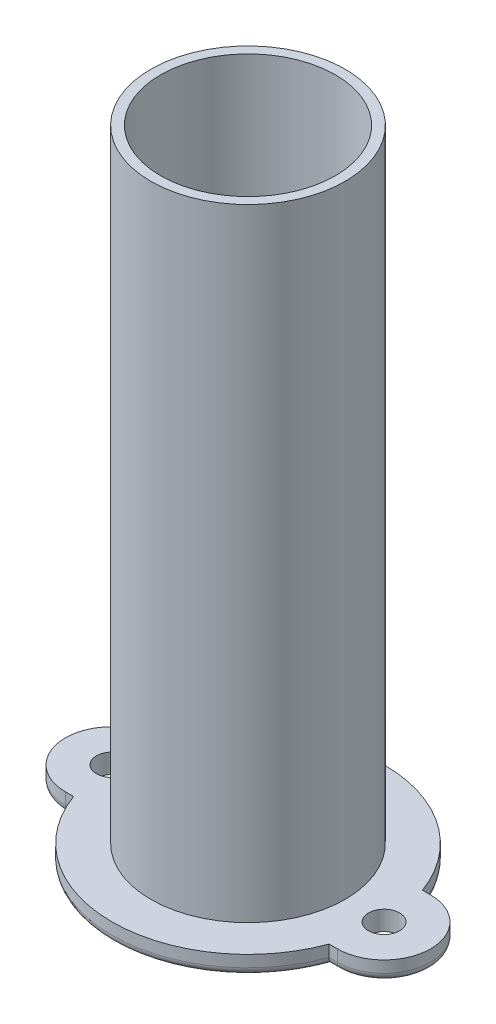
from build123d import *

# Parameters (mm, degrees)
CROQUIS1_R              = 11.25
CROQUIS1_R_2            = 2
SALIENTE_EXTRUIR2_DEPTH = 2.5
CROQUIS2_R              = 12.5
CROQUIS2_R_2            = 11.25
SALIENTE_EXTRUIR4_DEPTH = 80
REDONDEO1_R             = 1


with BuildPart() as part:
    # Croquis1 → Saliente-Extruir2 (new body)
    with BuildSketch(Plane(origin=(0, 0, 0), x_dir=(1, 0, 0), z_dir=(0, 1, 0))):
        with BuildLine():
            Line((-17.5, 6), (-16.439282223, 6))
            ThreePointArc((-16.439282223, 6), (0, 17.5), (16.439282223, 6))
            Line((16.439282223, 6), (17.5, 6))
            ThreePointArc((17.5, 6), (23.5, 0), (17.5, -6))
            Line((17.5, -6), (16.439282223, -6))
            ThreePointArc((16.439282223, -6), (0, -17.5), (-16.439282223, -6))
            Line((-16.439282223, -6), (-17.5, -6))
            ThreePointArc((-17.5, -6), (-23.5, 0), (-17.5, 6))
        make_face()
        with Locations(Location((0, 0, 0), (0, 0, 270))):
            Circle(CROQUIS1_R, mode=Mode.SUBTRACT)
        with Locations(Location((-17.5, 0, 0), (0, 0, 270))):
            Circle(CROQUIS1_R_2, mode=Mode.SUBTRACT)
        with Locations(Location((17.5, 0, 0), (0, 0, 270))):
            Circle(CROQUIS1_R_2, mode=Mode.SUBTRACT)
    extrude(amount=SALIENTE_EXTRUIR2_DEPTH)

    # Croquis2 → Saliente-Extruir4 (add)
    with BuildSketch(Plane(origin=(0, 2.5, 0), x_dir=(1, 0, 0), z_dir=(0, 1, 0))):
        with Locations(Location((0, 0, 0), (0, 0, 270))):
            Circle(CROQUIS2_R)
        with Locations(Location((0, 0, 0), (0, 0, 270))):
            Circle(CROQUIS2_R_2, mode=Mode.SUBTRACT)
    extrude(amount=SALIENTE_EXTRUIR4_DEPTH)

    # Redondeo1
    redondeo1_edges = [part.edges().sort_by_distance(p)[0] for p in [
        (16.969641111, 0, 6),
        (0, 0, 17.5),
        (-16.969641111, 0, 6),
        (-23.5, 0, 0),
        (0, 0, -11.25),
        (-16.969641111, 0, -6),
        (0, 0, -17.5),
        (16.969641111, 0, -6),
        (23.5, 0, 0),
    ]]
    fillet(redondeo1_edges, radius=REDONDEO1_R)


solid = part.part
